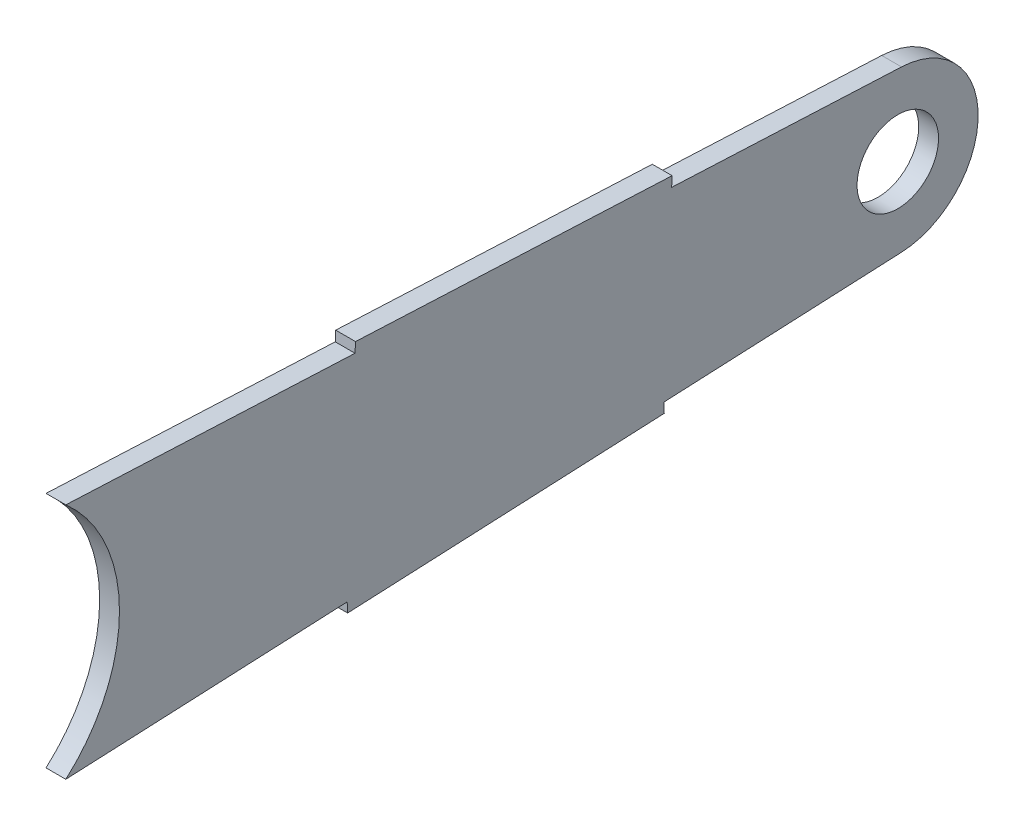
from build123d import *

# Parameters (mm, degrees)
SKETCH1_R           = 3.2639
BOSS_EXTRUDE1_DEPTH = 0.79375


with BuildPart() as part:
    # Sketch1 → Boss-Extrude1 (new, symmetric)
    with BuildSketch(Plane(origin=(0, 0, 0), x_dir=(0, 0, -1), z_dir=(1, 0, 0))):
        with BuildLine():
            Line((-43.495639045, 8.454512603), (-66.675, 9.525))
            ThreePointArc((-66.675, 9.525), (-62.375260413, 0), (-66.675, -9.525))
            Line((-66.675, -9.525), (-44.125906356, -8.483620102))
            Line((-44.125906356, -8.483620102), (-44.089248772, -9.277370102))
            Line((-44.089248772, -9.277370102), (-18.716292707, -8.105576378))
            Line((-18.716292707, -8.105576378), (-18.752950291, -7.311826378))
            Line((-18.752950291, -7.311826378), (0.297049709, -6.432044362))
            ThreePointArc((0.297049709, -6.432044362), (6.4389, 0), (0.297049709, 6.432044362))
            Line((0.297049709, 6.432044362), (-18.12268298, 7.28271888))
            Line((-18.12268298, 7.28271888), (-18.086064426, 8.075623757))
            Line((-18.086064426, 8.075623757), (-43.459020491, 9.24741748))
            Line((-43.459020491, 9.24741748), (-43.495639045, 8.454512603))
        make_face()
        Circle(SKETCH1_R, mode=Mode.SUBTRACT)
    extrude(amount=BOSS_EXTRUDE1_DEPTH, both=True)


solid = part.part
